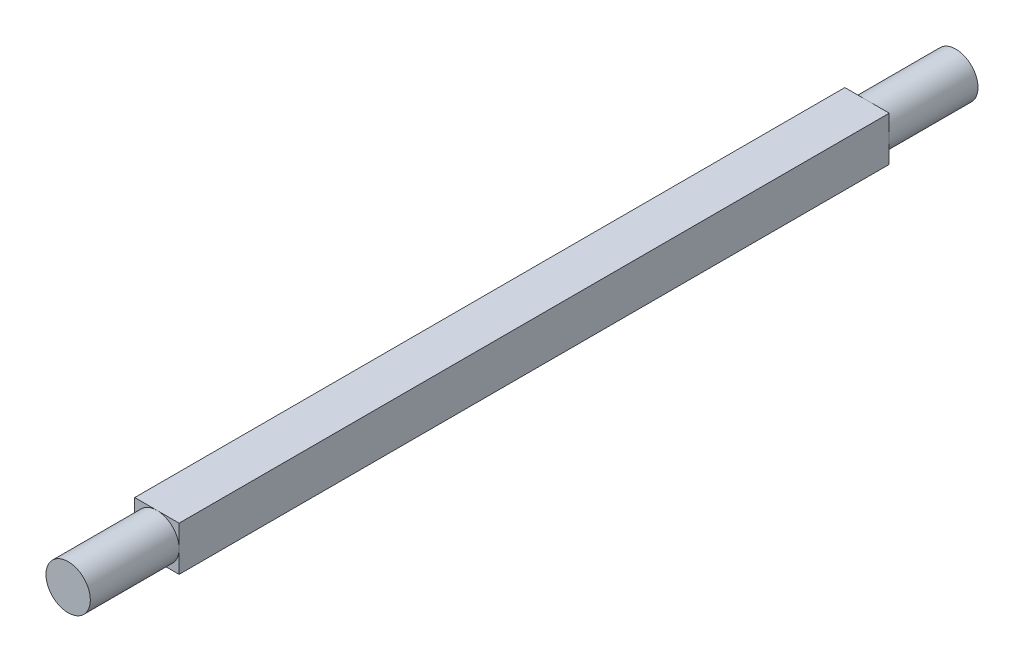
from build123d import *

# Parameters (mm, degrees)
SKETCH1_W           = 50
SKETCH1_H           = 50
BOSS_EXTRUDE1_DEPTH = 400
SKETCH2_R           = 25
BOSS_EXTRUDE2_DEPTH = 100


with BuildPart() as part:
    # Sketch1 → Boss-Extrude1 (new, symmetric)
    with BuildSketch(Plane.XY):
        Rectangle(SKETCH1_W, SKETCH1_H)
    extrude(amount=BOSS_EXTRUDE1_DEPTH, both=True)

    # Sketch2 → Boss-Extrude2 (add)
    with BuildSketch(Plane.XY.offset(400)):
        Circle(SKETCH2_R)
    boss_extrude2 = extrude(amount=BOSS_EXTRUDE2_DEPTH)

    # Mirror1: Boss-Extrude2 across plane
    add(boss_extrude2.mirror(Plane.XY))


solid = part.part
